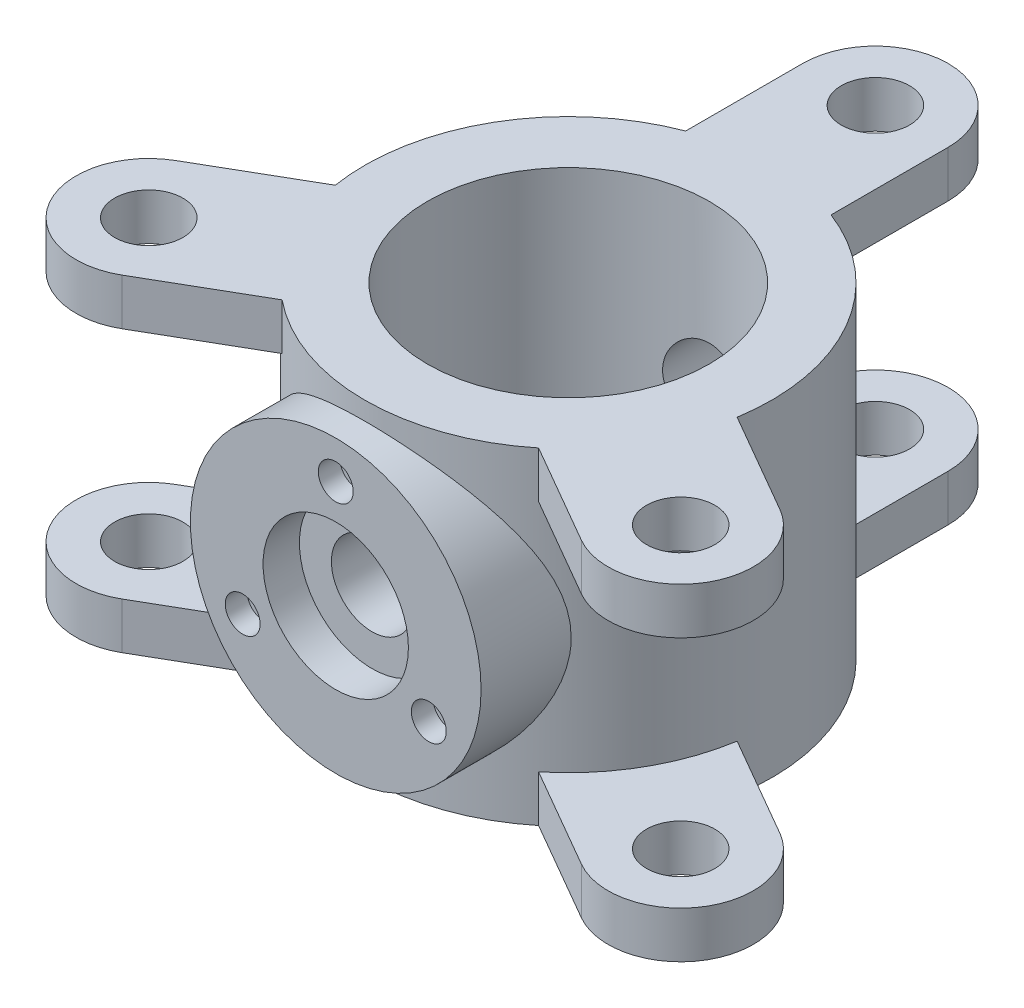
from build123d import *

# Parameters (mm, degrees)
SKETCH1_R                = 140
SKETCH1_R_2              = 97
BOSS_EXTRUDE3_DEPTH      = 225
BOSS_EXTRUDE4_START      = -32
SKETCH4_R                = 23.5
BOSS_EXTRUDE4_DEPTH      = 32
CIRPATTERN2_COUNT        = 3
MIRROR1_START            = -32
MIRROR1_COPY_1_SKETCH_R  = 23.5
MIRROR1_COPY_1_DEPTH     = 32
MIRROR1_COPY_2_SKETCH_R  = 23.5
MIRROR1_COPY_2_DEPTH     = 32
BOSS_EXTRUDE5_REACH      = 533.421
BOSS_EXTRUDE5_END_RADIUS = 140
SKETCH6_R                = 100
SKETCH7_R                = 50
CUT_EXTRUDE1_DEPTH       = 25
SKETCH8_R                = 28
CUT_EXTRUDE2_DEPTH       = 512.827938218
SKETCH9_R                = 12
CUT_EXTRUDE3_DEPTH       = 15
CIRPATTERN3_COUNT        = 3


with BuildPart() as part:
    # Sketch1 → Boss-Extrude3 (new body)
    with BuildSketch(Plane(origin=(0, 0, 0), x_dir=(1, 0, 0), z_dir=(0, 1, 0))):
        with Locations(Location((0, 0, 0), (0, 0, 270))):
            Circle(SKETCH1_R)
        with Locations(Location((0, 0, 0), (0, 0, 270))):
            Circle(SKETCH1_R_2, mode=Mode.SUBTRACT)
    extrude(amount=BOSS_EXTRUDE3_DEPTH)

    # Sketch4 → Boss-Extrude4 (add)
    with BuildSketch(Plane(origin=(0, 225, 0), x_dir=(1, 0, 0), z_dir=(0, 1, 0)).offset(BOSS_EXTRUDE4_START)):
        with BuildLine():
            ThreePointArc((50, 211.303564756), (0, 261.303564756), (-50, 211.303564756))
            Line((-50, 211.303564756), (-50, 130.766968306))
            ThreePointArc((-50, 130.766968306), (0, 140), (50, 130.766968306))
            Line((50, 130.766968306), (50, 211.303564756))
        make_face()
        with Locations(Location((0, 211.303564756, 0), (0, 0, 270))):
            Circle(SKETCH4_R, mode=Mode.SUBTRACT)
    boss_extrude4 = extrude(amount=BOSS_EXTRUDE4_DEPTH)

    # CirPattern2: Boss-Extrude4 ×3 about axis
    cirpattern2_axis = Axis((0, 0, 0), (0, 1, 0))
    for i in range(1, CIRPATTERN2_COUNT):
        add(boss_extrude4.rotate(cirpattern2_axis, i * 360 / CIRPATTERN2_COUNT))

    # Mirror1: Boss-Extrude4 across plane
    add(boss_extrude4.mirror(Plane.ZX.offset(112.5)))

    # Mirror1 copy 1 sketch → Mirror1 copy 1 (add)
    with BuildSketch(Plane(origin=(0, 0, 0), x_dir=(-0.4999999999999998, 0, -0.8660254037844387), z_dir=(0, -1, 0)).offset(MIRROR1_START)):
        with BuildLine():
            ThreePointArc((50, -211.303564756), (0, -261.303564756), (-50, -211.303564756))
            Line((-50, -211.303564756), (-50, -130.766968306))
            ThreePointArc((-50, -130.766968306), (0, -140), (50, -130.766968306))
            Line((50, -130.766968306), (50, -211.303564756))
        make_face()
        with Locations((0, -211.303564756)):
            Circle(MIRROR1_COPY_1_SKETCH_R, mode=Mode.SUBTRACT)
    extrude(amount=MIRROR1_COPY_1_DEPTH)

    # Mirror1 copy 2 sketch → Mirror1 copy 2 (add)
    with BuildSketch(Plane(origin=(0, 0, 0), x_dir=(-0.5000000000000004, 0, 0.8660254037844384), z_dir=(0, -1, 0)).offset(MIRROR1_START)):
        with BuildLine():
            ThreePointArc((50, -211.303564756), (0, -261.303564756), (-50, -211.303564756))
            Line((-50, -211.303564756), (-50, -130.766968306))
            ThreePointArc((-50, -130.766968306), (0, -140), (50, -130.766968306))
            Line((50, -130.766968306), (50, -211.303564756))
        make_face()
        with Locations((0, -211.303564756)):
            Circle(MIRROR1_COPY_2_SKETCH_R, mode=Mode.SUBTRACT)
    extrude(amount=MIRROR1_COPY_2_DEPTH)

    # Boss-Extrude5: up to this cylinder (the profile starts outside it)
    boss_extrude5_end = Plane(origin=(0, 112.5, 0), z_dir=(0, -1, 0)) * Cylinder(BOSS_EXTRUDE5_END_RADIUS, 1347.842, mode=Mode.PRIVATE)
    # Sketch6 → Boss-Extrude5 (add, up to the surface)
    with BuildSketch(Plane.XY.offset(160), mode=Mode.PRIVATE) as boss_extrude5_sk1:
        with Locations((0, 112.5)):
            Circle(SKETCH6_R)
    boss_extrude5_tool1 = extrude(boss_extrude5_sk1.sketch, amount=-BOSS_EXTRUDE5_REACH, mode=Mode.PRIVATE) - boss_extrude5_end
    add(boss_extrude5_tool1.solids().sort_by_distance((0, 112.5, 160))[0])

    # Sketch7 → Cut-Extrude1 (cut)
    with BuildSketch(Plane.XY.offset(160)):
        with Locations((0, 112.5)):
            Circle(SKETCH7_R)
    extrude(amount=-CUT_EXTRUDE1_DEPTH, mode=Mode.SUBTRACT)

    # Sketch8 → Cut-Extrude2 (cut, through all)
    with BuildSketch(Plane.XY.offset(135)):
        with Locations((0, 112.5)):
            Circle(SKETCH8_R)
    extrude(amount=-CUT_EXTRUDE2_DEPTH, mode=Mode.SUBTRACT)

    # Sketch9 → Cut-Extrude3 (cut)
    with BuildSketch(Plane.XY.offset(160)):
        with Locations((0, 186.428214738)):
            Circle(SKETCH9_R)
    cut_extrude3 = extrude(amount=-CUT_EXTRUDE3_DEPTH, mode=Mode.SUBTRACT)

    # CirPattern3: Cut-Extrude3 ×3 about axis
    cirpattern3_axis = Axis((0, 112.5, 0), (0, 0, 1))
    for i in range(1, CIRPATTERN3_COUNT):
        add(cut_extrude3.rotate(cirpattern3_axis, i * 360 / CIRPATTERN3_COUNT), mode=Mode.SUBTRACT)


solid = part.part
